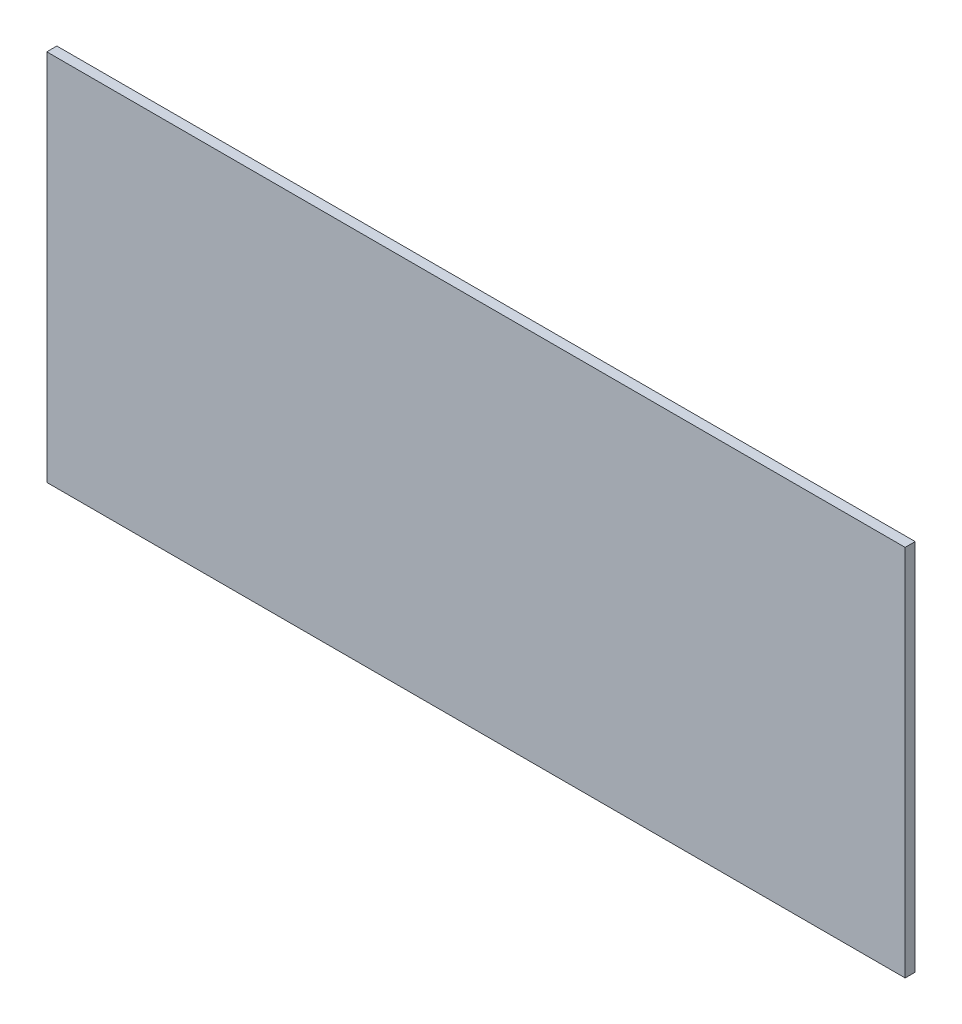
from build123d import *

# Parameters (mm, degrees)
SKETCH1_W           = 256.061147157
SKETCH1_H           = 111.25
BOSS_EXTRUDE1_DEPTH = 3


with BuildPart() as part:
    # Sketch1 → Boss-Extrude1 (new body)
    with BuildSketch(Plane.XY):
        with Locations((23.863471751, -52.625)):
            Rectangle(SKETCH1_W, SKETCH1_H)
    extrude(amount=BOSS_EXTRUDE1_DEPTH)


solid = part.part
